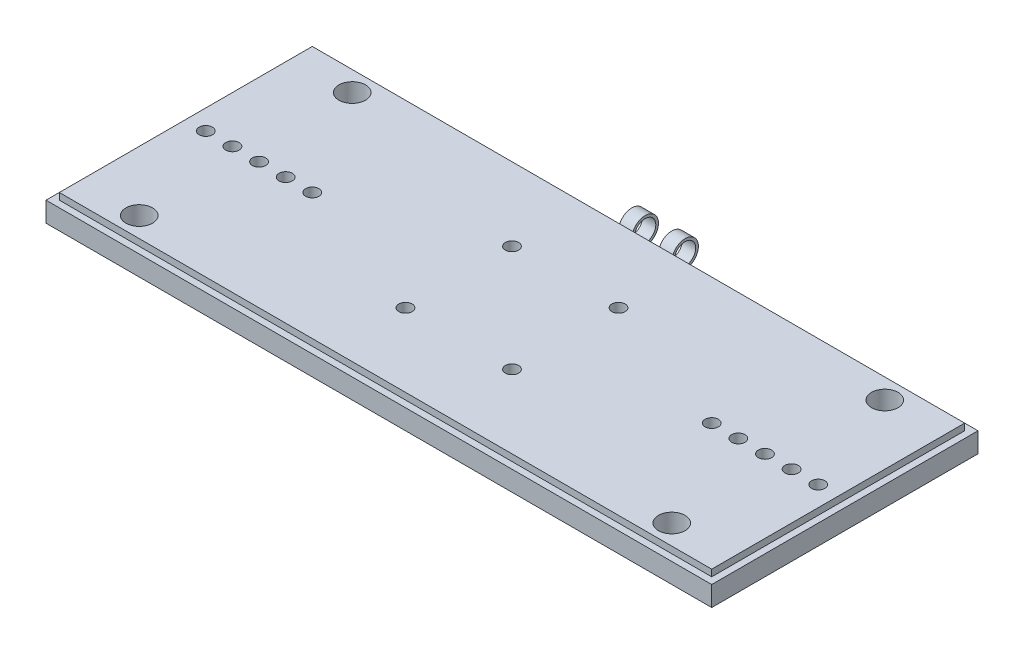
from build123d import *

# Parameters (mm, degrees)
SKETCH1_W           = 250
SKETCH1_H           = 100
SKETCH1_R           = 5
SKETCH1_R_2         = 2.5
BOSS_EXTRUDE1_DEPTH = 5
BOSS_EXTRUDE2_DEPTH = 10
CUT_EXTRUDE1_DEPTH  = 5
SKETCH4_R           = 4
CUT_EXTRUDE2_DEPTH  = 44.5
SKETCH5_W           = 5
SKETCH5_H           = 5
SKETCH5_W_2         = 2.5
CUT_EXTRUDE3_DEPTH  = 290.5
SKETCH6_W           = 5
SKETCH6_H           = 5
CUT_EXTRUDE4_DEPTH  = 290.5


with BuildPart() as part:
    # Sketch1 → Boss-Extrude1 (new, symmetric)
    with BuildSketch(Plane(origin=(0, 0, 0), x_dir=(1, 0, 0), z_dir=(0, 1, 0))):
        Rectangle(SKETCH1_W, SKETCH1_H)
        with Locations(Location((-100, 40, 0), (0, 0, 270))):
            Circle(SKETCH1_R, mode=Mode.SUBTRACT)
        with Locations(Location((100, 40, 0), (0, 0, 270))):
            Circle(SKETCH1_R, mode=Mode.SUBTRACT)
        with Locations(Location((-100, -40, 0), (0, 0, 90))):
            Circle(SKETCH1_R, mode=Mode.SUBTRACT)
        with Locations(Location((100, -40, 0), (0, 0, 90))):
            Circle(SKETCH1_R, mode=Mode.SUBTRACT)
        with Locations(Location((-20, 20, 0), (0, 0, 270))):
            Circle(SKETCH1_R_2, mode=Mode.SUBTRACT)
        with Locations(Location((20, 20, 0), (0, 0, 270))):
            Circle(SKETCH1_R_2, mode=Mode.SUBTRACT)
        with Locations(Location((-20, -20, 0), (0, 0, 270))):
            Circle(SKETCH1_R_2, mode=Mode.SUBTRACT)
        with Locations(Location((20, -20, 0), (0, 0, 270))):
            Circle(SKETCH1_R_2, mode=Mode.SUBTRACT)
        with Locations(Location((-115, 0, 0), (0, 0, 270))):
            Circle(SKETCH1_R_2, mode=Mode.SUBTRACT)
        with Locations(Location((-105, 0, 0), (0, 0, 270))):
            Circle(SKETCH1_R_2, mode=Mode.SUBTRACT)
        with Locations(Location((-95, 0, 0), (0, 0, 270))):
            Circle(SKETCH1_R_2, mode=Mode.SUBTRACT)
        with Locations(Location((-85, 0, 0), (0, 0, 270))):
            Circle(SKETCH1_R_2, mode=Mode.SUBTRACT)
        with Locations(Location((-75, 0, 0), (0, 0, 270))):
            Circle(SKETCH1_R_2, mode=Mode.SUBTRACT)
        with Locations(Location((75, 0, 0), (0, 0, 90))):
            Circle(SKETCH1_R_2, mode=Mode.SUBTRACT)
        with Locations(Location((85, 0, 0), (0, 0, 90))):
            Circle(SKETCH1_R_2, mode=Mode.SUBTRACT)
        with Locations(Location((95, 0, 0), (0, 0, 90))):
            Circle(SKETCH1_R_2, mode=Mode.SUBTRACT)
        with Locations(Location((105, 0, 0), (0, 0, 90))):
            Circle(SKETCH1_R_2, mode=Mode.SUBTRACT)
        with Locations(Location((115, 0, 0), (0, 0, 90))):
            Circle(SKETCH1_R_2, mode=Mode.SUBTRACT)
    extrude(amount=BOSS_EXTRUDE1_DEPTH, both=True)

    # Sketch2 → Boss-Extrude2 (add, symmetric)
    with BuildSketch(Plane(origin=(0, 0, 0), x_dir=(0, 0, -1), z_dir=(1, 0, 0))):
        with BuildLine():
            Line((55, -5), (50, -5))
            Line((50, -5), (50, 0))
            ThreePointArc((50, 0), (58.535533906, 3.535533906), (55, -5))
        make_face()
    extrude(amount=BOSS_EXTRUDE2_DEPTH, both=True)

    # Sketch3 → Cut-Extrude1 (cut, symmetric)
    with BuildSketch(Plane(origin=(0, 0, 0), x_dir=(0, 0, -1), z_dir=(1, 0, 0))):
        Polygon((50, 5), (50, -6.022521845), (64.637798631, -7.270431104), (61.921760831, 9.282718187), align=None)
    extrude(amount=CUT_EXTRUDE1_DEPTH, both=True, mode=Mode.SUBTRACT)

    # Sketch4 → Cut-Extrude2 (cut, symmetric)
    with BuildSketch(Plane(origin=(10, 0, 0), x_dir=(0, 0, -1), z_dir=(1, 0, 0))):
        with Locations((55, 0)):
            Circle(SKETCH4_R)
    extrude(amount=CUT_EXTRUDE2_DEPTH, both=True, mode=Mode.SUBTRACT)

    # Sketch5 → Cut-Extrude3 (cut, symmetric)
    with BuildSketch(Plane(origin=(125, 0, 0), x_dir=(0, 0, -1), z_dir=(1, 0, 0))):
        with Locations((-50, 5)):
            Rectangle(SKETCH5_W, SKETCH5_H)
        with Locations((48.75, 5)):
            Rectangle(SKETCH5_W_2, SKETCH5_H)
    extrude(amount=CUT_EXTRUDE3_DEPTH, both=True, mode=Mode.SUBTRACT)

    # Sketch6 → Cut-Extrude4 (cut, symmetric)
    with BuildSketch(Plane.XY):
        with Locations((125, 5)):
            Rectangle(SKETCH6_W, SKETCH6_H)
        with Locations((-125, 5)):
            Rectangle(SKETCH6_W, SKETCH6_H)
    extrude(amount=CUT_EXTRUDE4_DEPTH, both=True, mode=Mode.SUBTRACT)


solid = part.part
